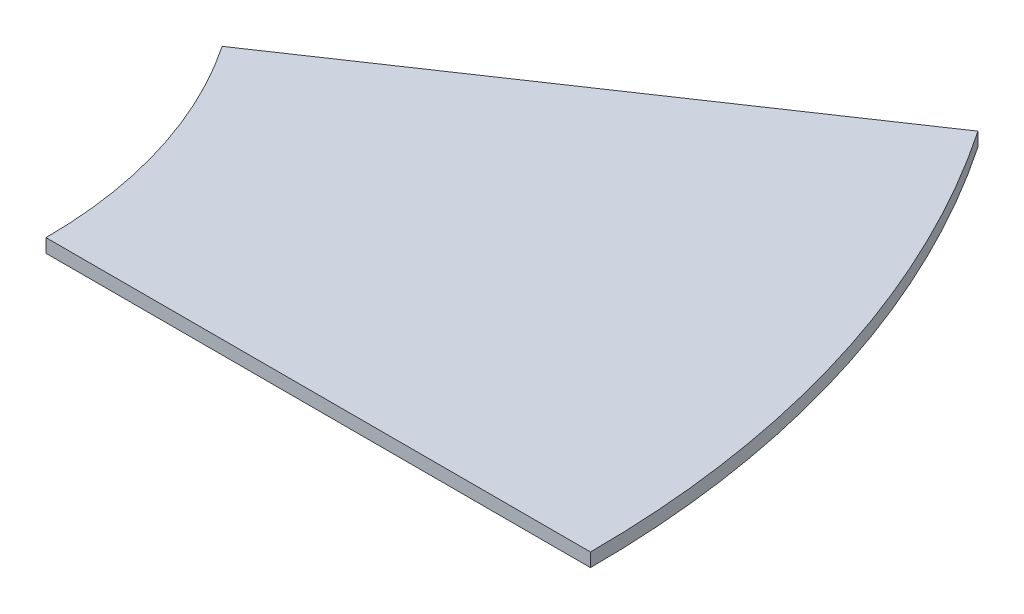
from build123d import *

# Parameters (mm, degrees)
EXTRUDE_1_DEPTH = 1.5


with BuildPart() as part:
    # 草图1 → 凸台-拉伸1 (new body)
    with BuildSketch(Plane(origin=(0, 0, 0), x_dir=(1, 0, 0), z_dir=(0, 1, 0))):
        with BuildLine():
            Line((91.194132981, 61.511219382), (41.451878628, 27.959645174))
            ThreePointArc((41.451878628, 27.959645174), (47.815237798, 14.618585236), (50, 0))
            Line((50, 0), (110, 0))
            ThreePointArc((110, 0), (105.193523156, 32.16088752), (91.194132981, 61.511219382))
        make_face()
    extrude(amount=EXTRUDE_1_DEPTH)


solid = part.part
